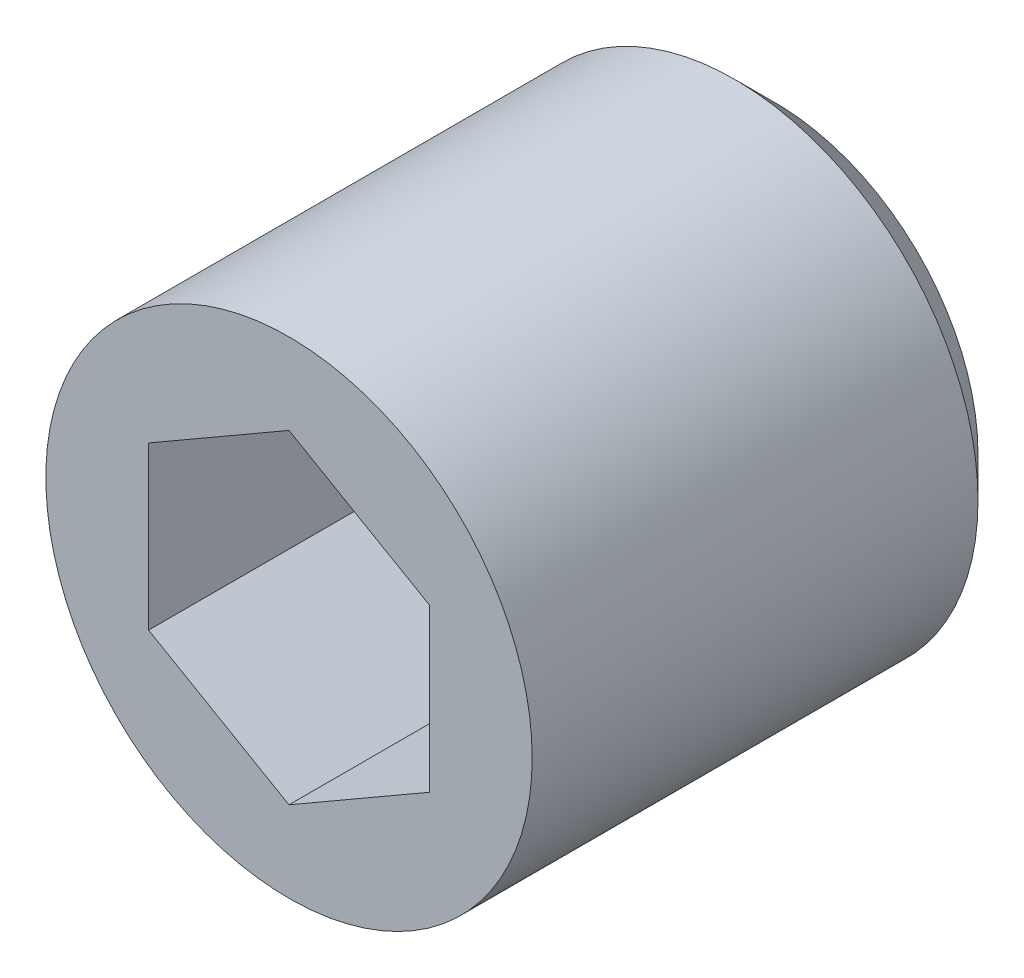
from build123d import *

# Parameters (mm, degrees)
ESQUISSE1_R                       = 3
BOSS_EXTRU_1_DEPTH                = 6
CHANFREIN1_SIZE                   = 0.5
DIAM_TRE_DU_PER_AGE_4_0_4_1_D     = 4
DIAM_TRE_DU_PER_AGE_4_0_4_1_DEPTH = 3.798278762
DIAM_TRE_DU_PER_AGE_4_0_4_1_TIP   = 1.201721238
BOSS_EXTRU_3_START                = -5
ESQUISSE2_R                       = 3
BOSS_EXTRU_3_DEPTH                = 5
DIAM_TRE_DU_PER_AGE_1_0_1_1_D     = 1
DIAM_TRE_DU_PER_AGE_1_0_1_1_DEPTH = 1.5
DIAM_TRE_DU_PER_AGE_1_0_1_1_TIP   = 0.30043031


with BuildPart() as part:
    # Esquisse1 → Boss.-Extru.1 (new body)
    with BuildSketch(Plane.XY):
        Circle(ESQUISSE1_R)
    extrude(amount=BOSS_EXTRU_1_DEPTH)

    # Chanfrein1
    chanfrein1_edges = [part.edges().sort_by_distance(p)[0] for p in [
        (-3, 0, 0),
    ]]
    chamfer(chanfrein1_edges, length=CHANFREIN1_SIZE)

    # Diamètre du perçage Ø4.0 (4)1
    with Locations(Plane.XY.offset(6)):
        with Locations((0, 0)):
            Hole(DIAM_TRE_DU_PER_AGE_4_0_4_1_D / 2, depth=DIAM_TRE_DU_PER_AGE_4_0_4_1_DEPTH)
            with Locations((0, 0, -(DIAM_TRE_DU_PER_AGE_4_0_4_1_DEPTH + DIAM_TRE_DU_PER_AGE_4_0_4_1_TIP / 2))):  # 118° drill point
                Cone(0, DIAM_TRE_DU_PER_AGE_4_0_4_1_D / 2, DIAM_TRE_DU_PER_AGE_4_0_4_1_TIP, mode=Mode.SUBTRACT)

    # Esquisse2 → Boss.-Extru.3 (add)
    with BuildSketch(Plane.XY.offset(6).offset(BOSS_EXTRU_3_START)):
        Circle(ESQUISSE2_R)
        Polygon((0, 2), (1.732050808, 1), (1.732050808, -1), (0, -2), (-1.732050808, -1), (-1.732050808, 1), align=None, mode=Mode.SUBTRACT)
    extrude(amount=BOSS_EXTRU_3_DEPTH)

    # Diamètre du perçage Ø1.0 (1)1
    with Locations(Plane(origin=(0, 0, 0), x_dir=(-1, 0, 0), z_dir=(0, 0, -1))):
        with Locations((0, 0)):
            Hole(DIAM_TRE_DU_PER_AGE_1_0_1_1_D / 2, depth=DIAM_TRE_DU_PER_AGE_1_0_1_1_DEPTH)
            with Locations((0, 0, -(DIAM_TRE_DU_PER_AGE_1_0_1_1_DEPTH + DIAM_TRE_DU_PER_AGE_1_0_1_1_TIP / 2))):  # 118° drill point
                Cone(0, DIAM_TRE_DU_PER_AGE_1_0_1_1_D / 2, DIAM_TRE_DU_PER_AGE_1_0_1_1_TIP, mode=Mode.SUBTRACT)


solid = part.part
